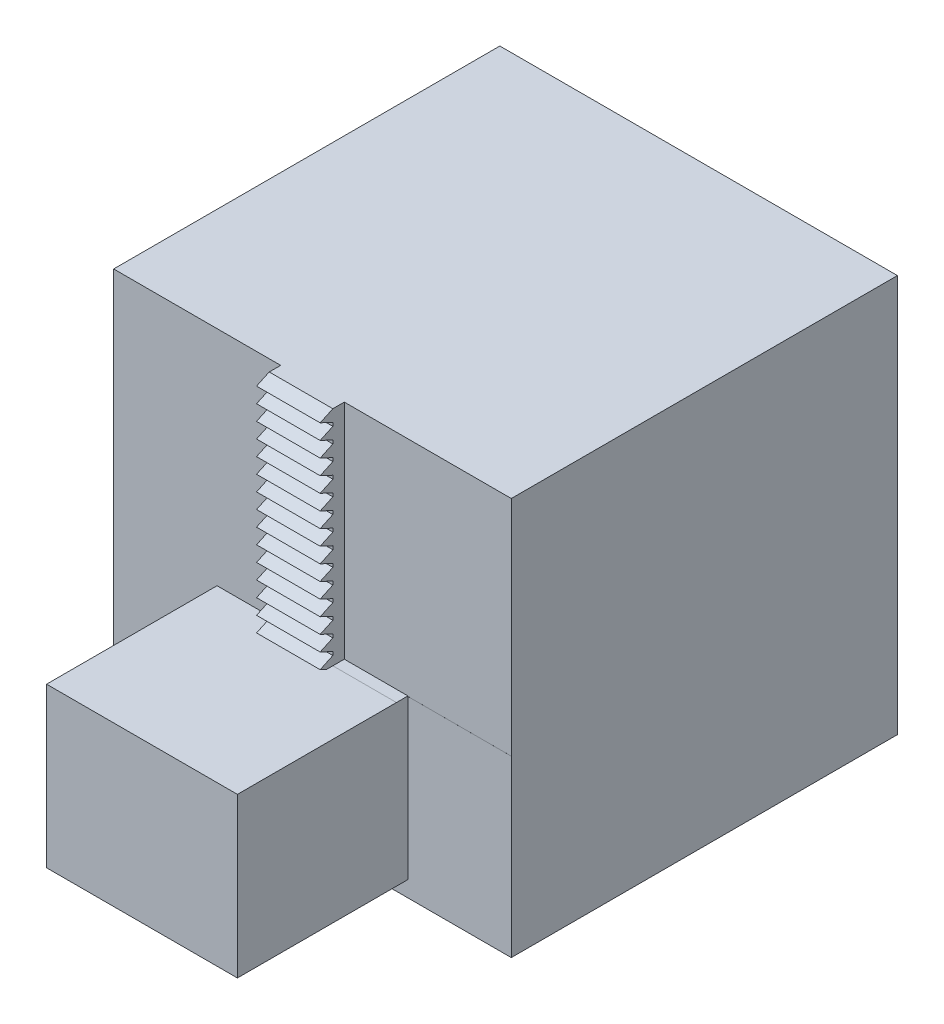
from build123d import *

# Parameters (mm, degrees)
SKETCH1_W           = 25
SKETCH1_H           = 25
BOSS_EXTRUDE1_DEPTH = 25
SKETCH2_W           = 12
SKETCH2_H           = 10
BOSS_EXTRUDE2_DEPTH = 10
BOSS_EXTRUDE4_DEPTH = 2
LPATTERN1_COUNT     = 15
LPATTERN1_PITCH     = 0.96
CUT_EXTRUDE1_REACH  = 43.908
SKETCH4_W           = 0.720746126
SKETCH4_H           = 14.030445764
SKETCH5_W           = 10.5
SKETCH5_H           = 0.72
CUT_EXTRUDE2_DEPTH  = 14.3
CUT_EXTRUDE3_DEPTH  = 0.72
BOSS_EXTRUDE5_REACH = 40.386
SKETCH8_W           = 0.72
SKETCH8_H           = 0.3
SKETCH10_W          = 0.720746126
SKETCH10_H          = 0.030490047
BOSS_EXTRUDE6_DEPTH = 4


with BuildPart() as part:
    # Sketch1 → Boss-Extrude1 (new body)
    with BuildSketch(Plane(origin=(0, 0, 0), x_dir=(1, 0, 0), z_dir=(0, 1, 0))):
        Rectangle(SKETCH1_W, SKETCH1_H)
    extrude(amount=BOSS_EXTRUDE1_DEPTH)

    # Sketch2 → Boss-Extrude2 (add)
    with BuildSketch(Plane.XY.offset(12.5)):
        with Locations((0, 6)):
            Rectangle(SKETCH2_W, SKETCH2_H)
    extrude(amount=BOSS_EXTRUDE2_DEPTH)

    # Sketch3 → Boss-Extrude4 (add, symmetric)
    with BuildSketch(Plane(origin=(0, 0, 0), x_dir=(0, 0, -1), z_dir=(1, 0, 0))):
        Polygon((-12.5, 25), (-12.5, 24.2574888), (-13.297852918, 24.6287444), align=None)
    boss_extrude4 = extrude(amount=BOSS_EXTRUDE4_DEPTH, both=True)

    # LPattern1: Boss-Extrude4 ×15
    with Locations(*[(0, -i * LPATTERN1_PITCH, 0) for i in range(1, LPATTERN1_COUNT)]):
        add(boss_extrude4)

    # Cut-Extrude1: up to this face of the body (flat: up to its plane)
    cut_extrude1_end = Plane(part.part.faces().sort_by_distance((2, 24.6287444, 12.765950973))[0])
    # Sketch4 → Cut-Extrude1 (cut, up to the picked face)
    with BuildSketch(Plane(origin=(12.5, 0, 0), x_dir=(0, 0, -1), z_dir=(1, 0, 0)), mode=Mode.PRIVATE) as cut_extrude1_sk1:
        with Locations((-12.139626937, 17.984777118)):
            Rectangle(SKETCH4_W, SKETCH4_H)
    cut_extrude1_tool1 = split(extrude(cut_extrude1_sk1.sketch, amount=-CUT_EXTRUDE1_REACH, mode=Mode.PRIVATE), bisect_by=cut_extrude1_end, keep=Keep.BOTH, mode=Mode.PRIVATE)
    add(cut_extrude1_tool1.solids().sort_by(Axis((12.5, 17.984777, 12.139627), (-1, 0, 0)))[0], mode=Mode.SUBTRACT)

    # Sketch5 → Cut-Extrude2 (cut)
    with BuildSketch(Plane(origin=(0, 25, 0), x_dir=(1, 0, 0), z_dir=(0, 1, 0))):
        with Locations((-7.25, -12.14)):
            Rectangle(SKETCH5_W, SKETCH5_H)
    extrude(amount=-CUT_EXTRUDE2_DEPTH, mode=Mode.SUBTRACT)

    # Sketch7 → Cut-Extrude3 (cut)
    with BuildSketch(Plane.XY.offset(12.5)):
        Polygon((-6, 10.7), (-12.5, 10.7), (-12.5, 0), (12.5, 0), (12.5, 10.969554236), (6, 10.969554236), (6, 1), (-6, 1), align=None)
    extrude(amount=-CUT_EXTRUDE3_DEPTH, mode=Mode.SUBTRACT)

    # Sketch8 → Boss-Extrude5 (add, up to next)
    with BuildSketch(Plane.ZY.offset(6), mode=Mode.PRIVATE) as boss_extrude5_sk1:
        with Locations((12.14, 10.85)):
            Rectangle(SKETCH8_W, SKETCH8_H)
    boss_extrude5_tool1 = extrude(boss_extrude5_sk1.sketch, amount=-BOSS_EXTRUDE5_REACH, mode=Mode.PRIVATE) - part.part
    add(boss_extrude5_tool1.solids().sort_by_distance((-6, 10.85, 12.14))[0])

    # Sketch10 → Boss-Extrude6 (add)
    with BuildSketch(Plane(origin=(2, 0, 0), x_dir=(0, 0, -1), z_dir=(1, 0, 0))):
        with Locations((-12.139626937, 10.98479926)):
            Rectangle(SKETCH10_W, SKETCH10_H)
    extrude(amount=BOSS_EXTRUDE6_DEPTH)


solid = part.part
